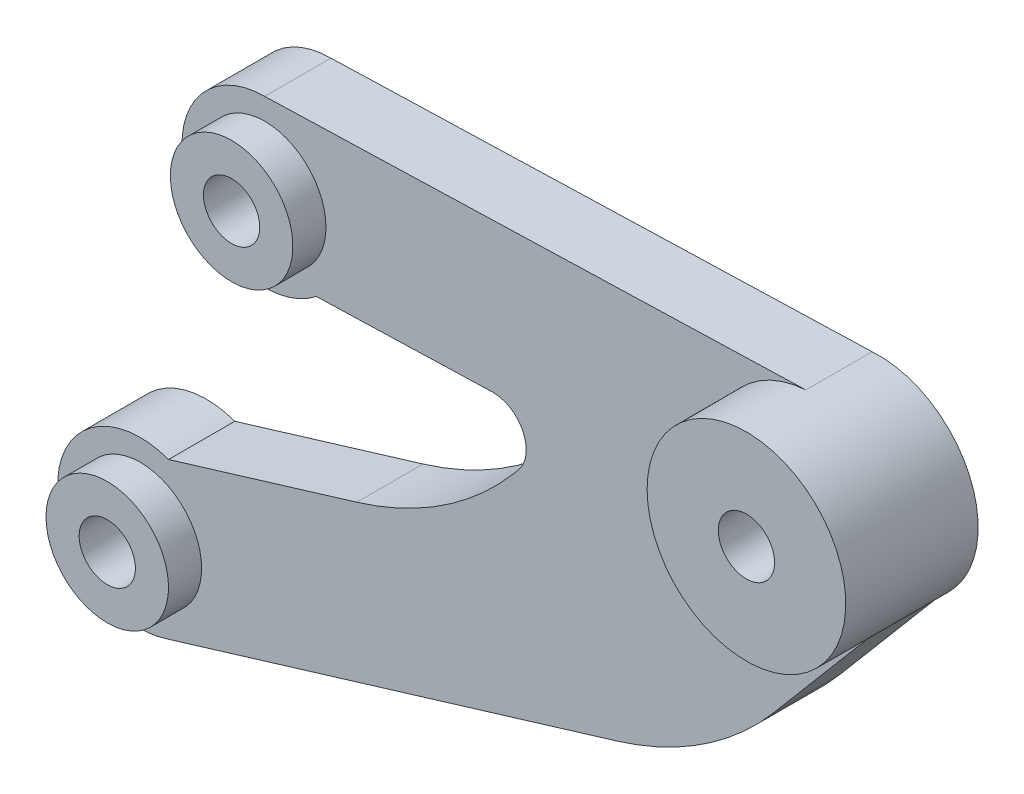
from build123d import *
from build123d.topology import SkipClean

# Parameters (mm, degrees)
BOSS_EXTRUDE1_DEPTH      = 2
BOSS_EXTRUDE1_DEPTH_BACK = 2
SKETCH2_R                = 1.7
FILLET1_R                = 20
SKETCH7_R                = 6
SKETCH7_R_2              = 1.7
BOSS_EXTRUDE4_DEPTH      = 4
SKETCH8_R                = 3.7
SKETCH8_R_2              = 1.7
BOSS_EXTRUDE5_DEPTH      = 2
FILLET4_R                = 2


with BuildPart() as part:
    # Sketch2 → Boss-Extrude1 (new, two sides: drawn at the far end of the back side and taken through both)
    with BuildSketch(Plane.XY.offset(-BOSS_EXTRUDE1_DEPTH_BACK)):
        with BuildLine():
            ThreePointArc((1.70658462, 4.699741369), (-4.999520368, 0.069253832), (1.575752274, -4.745208612))
            Line((1.575752274, -4.745208612), (34.456924853, 5.232629629))
            Line((34.456924853, 5.232629629), (44.296635241, 16.864742156))
            ThreePointArc((44.296635241, 16.864742156), (46.218376178, 23.740514028), (40.203783054, 27.586810508))
            Line((40.203783054, 27.586810508), (7.512886707, 26.600773906))
            ThreePointArc((7.512886707, 26.600773906), (2.79322071, 19.950091357), (10.629154827, 17.690675057))
            Line((10.629154827, 17.690675057), (25.733767379, 18.146266751))
            Line((25.733767379, 18.146266751), (18.728666276, 9.86511608))
            Line((18.728666276, 9.86511608), (1.70658462, 4.699741369))
        make_face()
        Circle(SKETCH2_R, mode=Mode.SUBTRACT)
        with Locations((7.512886707, 21.600773906)):
            Circle(SKETCH2_R, mode=Mode.SUBTRACT)
        with Locations((40.612886707, 21.600773906)):
            Circle(SKETCH2_R, mode=Mode.SUBTRACT)
    extrude(amount=BOSS_EXTRUDE1_DEPTH + BOSS_EXTRUDE1_DEPTH_BACK)

    # Fillet1
    fillet1_edges = [part.edges().sort_by_distance(p)[0] for p in [
        (34.456924853, 5.232629629, 0),
        (18.728666276, 9.86511608, 0),
    ]]
    fillet(fillet1_edges, radius=FILLET1_R)

    # Sketch7 → Boss-Extrude4 (add)
    with SkipClean():  # the faces are left unmerged after this step: merging them gives an invalid solid
        with BuildSketch(Plane(origin=(0, 0, 2), x_dir=(-1, 0, 0), z_dir=(0, 0, -1))):
            with Locations((-40.612886707, 21.600773906)):
                Circle(SKETCH7_R)
            with Locations((-40.612886707, 21.600773906)):
                Circle(SKETCH7_R_2, mode=Mode.SUBTRACT)
        extrude(amount=-BOSS_EXTRUDE4_DEPTH)

    # Sketch8 → Boss-Extrude5 (add)
    # profile 1 of 2: a face of its own
    with SkipClean():  # the faces are left unmerged after this step: merging them gives an invalid solid
        with BuildSketch(Plane(origin=(0, 0, 2), x_dir=(-1, 0, 0), z_dir=(0, 0, -1))):
            with Locations((-7.512886707, 21.600773906)):
                Circle(SKETCH8_R)
            with Locations((-7.512886707, 21.600773906)):
                Circle(SKETCH8_R_2, mode=Mode.SUBTRACT)
        # profile 2 of 2: a face of its own
        with BuildSketch(Plane(origin=(0, 0, 2), x_dir=(-1, 0, 0), z_dir=(0, 0, -1))):
            Circle(SKETCH8_R)
            Circle(SKETCH8_R_2, mode=Mode.SUBTRACT)
        extrude(amount=-BOSS_EXTRUDE5_DEPTH)

    # Fillet4
    fillet4_edges = [part.edges().sort_by_distance(p)[0] for p in [
        (25.733767379, 18.146266751, 0),
    ]]
    fillet(fillet4_edges, radius=FILLET4_R)


solid = part.part
